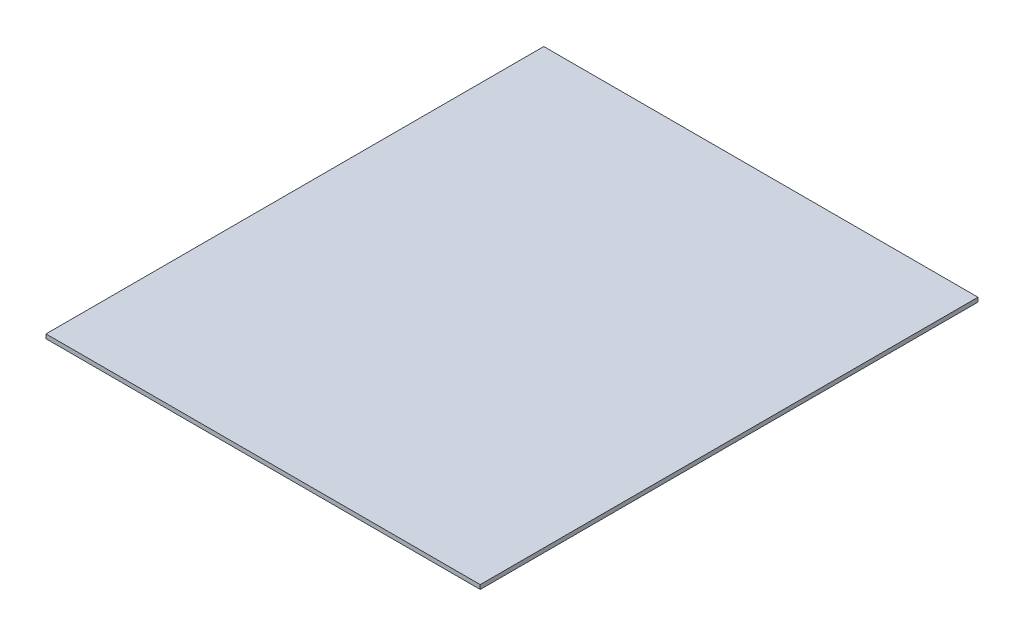
from build123d import *

# Parameters (mm, degrees)
SKETCH1_W           = 410
SKETCH1_H           = 470
BOSS_EXTRUDE1_DEPTH = 4


with BuildPart() as part:
    # Sketch1 → Boss-Extrude1 (new body)
    with BuildSketch(Plane(origin=(0, 0, 0), x_dir=(1, 0, 0), z_dir=(0, 1, 0))):
        Rectangle(SKETCH1_W, SKETCH1_H)
    extrude(amount=BOSS_EXTRUDE1_DEPTH)


solid = part.part
